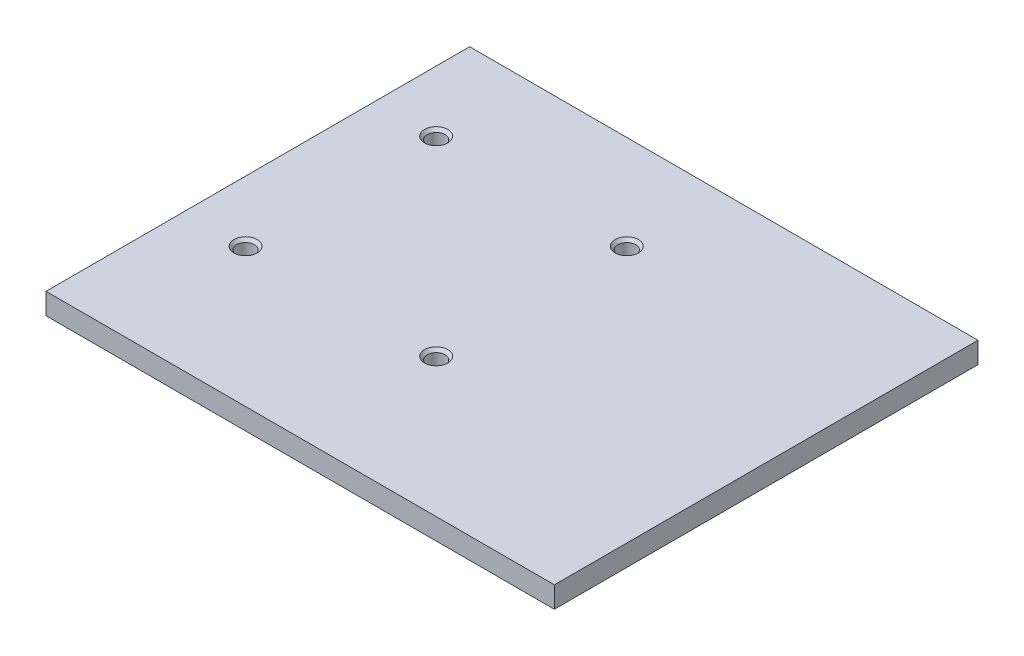
from build123d import *

# Parameters (mm, degrees)
SKETCH1_W                         = 304.8
SKETCH1_H                         = 254
BOSS_EXTRUDE1_DEPTH               = 12.7
F_1_2_13_TAPPED_HOLE1_D           = 10.71626
F_1_2_13_TAPPED_HOLE1_CSINK_D     = 13.97
F_1_2_13_TAPPED_HOLE1_CSINK_ANGLE = 82


with BuildPart() as part:
    # Sketch1 → Boss-Extrude1 (new body)
    with BuildSketch(Plane(origin=(0, 0, 0), x_dir=(1, 0, 0), z_dir=(0, 1, 0))):
        Rectangle(SKETCH1_W, SKETCH1_H)
    extrude(amount=BOSS_EXTRUDE1_DEPTH)

    # 1/2-13 Tapped Hole1 (through all)
    with Locations(Plane(origin=(0, 12.7, 0), x_dir=(1, 0, 0), z_dir=(0, 1, 0))):
        with Locations((-115.9794742, 70.518880845), (-1.6794742, 70.518880845), (-1.6794742, -43.781119155), (-115.9794742, -43.781119155)):
            CounterSinkHole(F_1_2_13_TAPPED_HOLE1_D / 2, F_1_2_13_TAPPED_HOLE1_CSINK_D / 2, counter_sink_angle=F_1_2_13_TAPPED_HOLE1_CSINK_ANGLE)


solid = part.part
